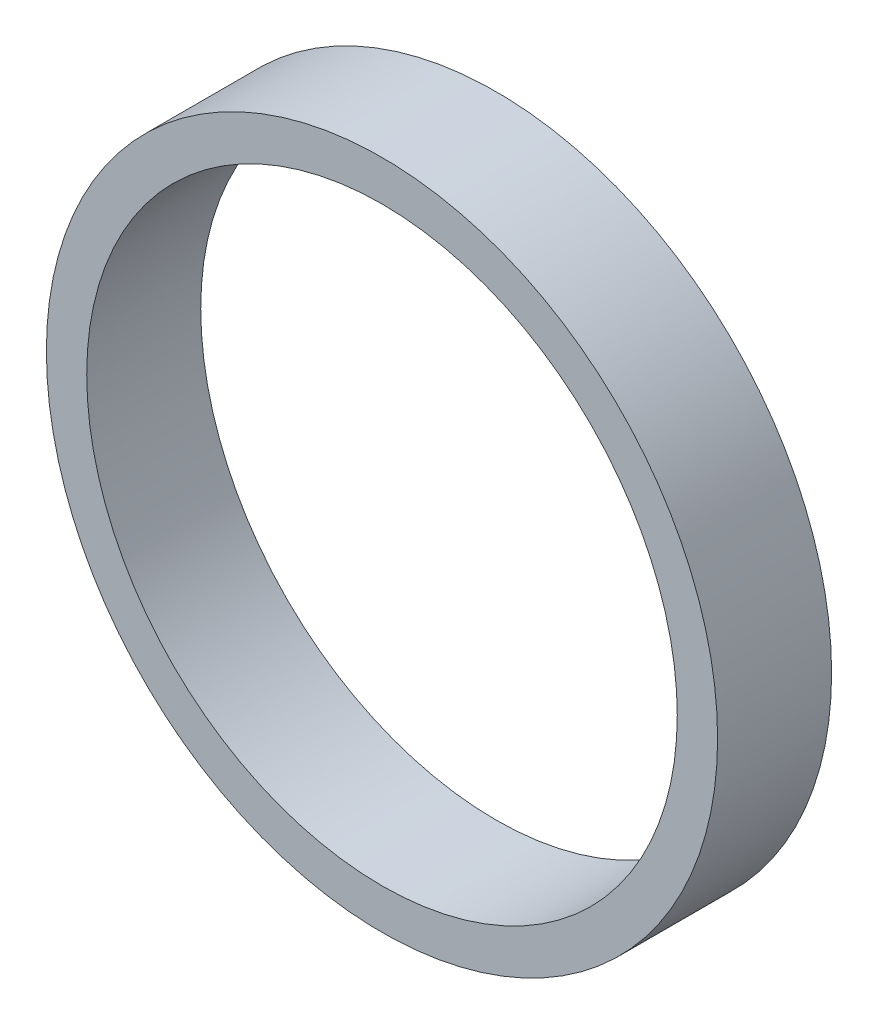
from build123d import *

# Parameters (mm, degrees)
SKETCH9_W = 0.351648352
SKETCH9_H = 0.99388875


with BuildPart() as part:
    # Sketch9 → Revolve5 (revolve)
    with BuildSketch(Plane(origin=(0, 0, 0), x_dir=(1, 0, 0), z_dir=(0, 1, 0))):
        with Locations((2.75, 0)):
            Rectangle(SKETCH9_W, SKETCH9_H)
    revolve(axis=Axis((0, 0, -0.496944375), (0, 0, 1)))


solid = part.part
